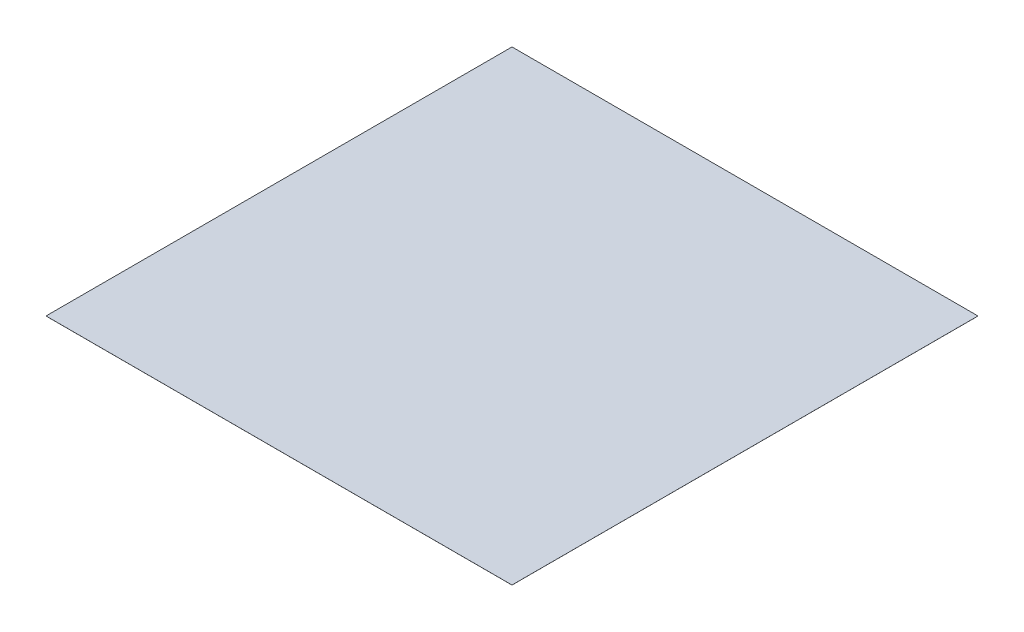
from build123d import *

# Parameters (mm, degrees)
SKETCH1_W           = 254
SKETCH1_H           = 254
BOSS_EXTRUDE1_DEPTH = 0.0254


with BuildPart() as part:
    # Sketch1 → Boss-Extrude1 (new body)
    with BuildSketch(Plane(origin=(0, 0, 0), x_dir=(1, 0, 0), z_dir=(0, 1, 0))):
        with Locations((127, 127)):
            Rectangle(SKETCH1_W, SKETCH1_H)
    extrude(amount=BOSS_EXTRUDE1_DEPTH)


solid = part.part
